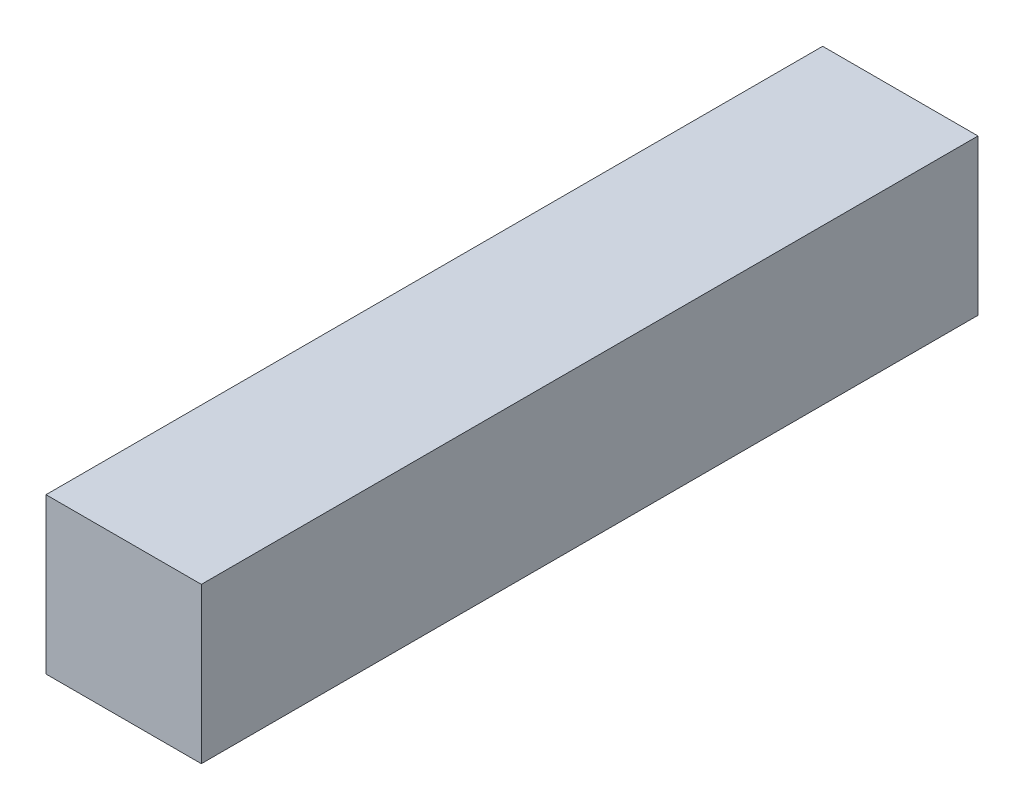
from build123d import *

# Parameters (mm, degrees)
SKETCH1_W      = 25.4
SKETCH1_H      = 25.4
EXTRUDE1_DEPTH = 127


with BuildPart() as part:
    # Sketch1 → Extrude1 (new body)
    with BuildSketch(Plane.XY):
        with Locations((12.7, 12.7)):
            Rectangle(SKETCH1_W, SKETCH1_H)
    extrude(amount=EXTRUDE1_DEPTH)


solid = part.part
